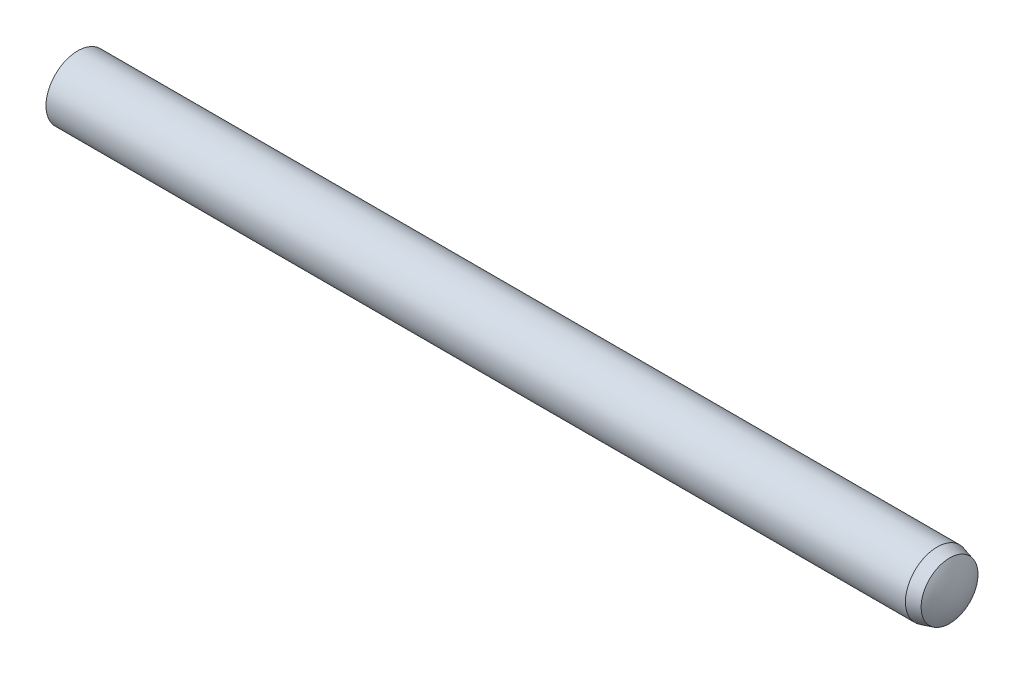
from build123d import *

# Parameters (mm, degrees)
EXTRUDE1_DEPTH      = 35
EXTRUDE1_DEPTH_BACK = 35
SKETCH2_R           = 2.5


with BuildPart() as part:
    # Sketch2 → Extrude1 (new, two sides: drawn at the far end of the back side and taken through both)
    with BuildSketch(Plane(origin=(0, 0, 0), x_dir=(0, 0, -1), z_dir=(1, 0, 0)).offset(-EXTRUDE1_DEPTH_BACK)):
        Circle(SKETCH2_R)
    extrude(amount=EXTRUDE1_DEPTH + EXTRUDE1_DEPTH_BACK)

    # Sketch5 → Cut-Revolve1 (revolve, cut)
    with BuildSketch(Plane.XY, mode=Mode.PRIVATE) as cut_revolve1_sk:
        with BuildLine():
            Line((33.375, 2.5), (33.375, 3))
            Line((33.375, 3), (35.5, 3))
            Line((35.5, 3), (35.5, 0))
            Line((35.5, 0), (35, 0))
            ThreePointArc((35, 0), (34.834212566, 1.165600649), (34.35, 2.238749537))
            Line((34.35, 2.238749537), (33.375, 2.5))
        make_face()
        with BuildLine():
            Line((-34.25, 2.5), (-34.25, 3))
            Line((-34.25, 3), (-35.5, 3))
            Line((-35.5, 3), (-35.5, 0))
            Line((-35.5, 0), (-35, 0))
            ThreePointArc((-35, 0), (-34.808461045, 1.305038314), (-34.25, 2.5))
        make_face()
    revolve(cut_revolve1_sk.sketch.rotate(Axis((-35, 0, 0), (1, 0, 0)), 90), axis=Axis((-35, 0, 0), (1, 0, 0)), mode=Mode.SUBTRACT)


solid = part.part
